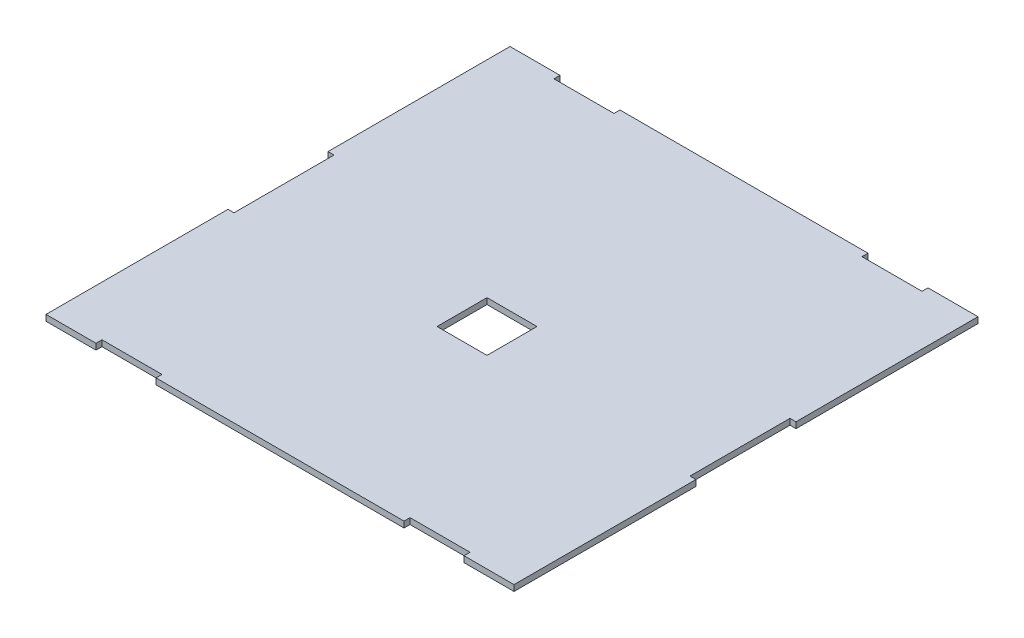
from build123d import *

# Parameters (mm, degrees)
ESBO_O1_W                = 25
ESBO_O1_H                = 25
RESSALTO_EXTRUS_O3_DEPTH = 3


with BuildPart() as part:
    # Esboço1 → Ressalto-extrusão3 (new body)
    with BuildSketch(Plane(origin=(0, 0, 0), x_dir=(1, 0, 0), z_dir=(0, 1, 0))):
        Polygon((0, 91), (0, 0), (25, 0), (25, 3), (55, 3), (55, 0), (179, 0), (179, 3), (209, 3), (209, 0), (234, 0), (234, 91), (231, 91), (231, 141), (234, 141), (234, 232), (209, 232), (209, 229), (179, 229), (179, 232), (55, 232), (55, 229), (25, 229), (25, 232), (0, 232), (0, 141), (3, 141), (3, 91), align=None)
        with Locations((115.5, 105)):
            Rectangle(ESBO_O1_W, ESBO_O1_H, mode=Mode.SUBTRACT)
    extrude(amount=RESSALTO_EXTRUS_O3_DEPTH)


solid = part.part
